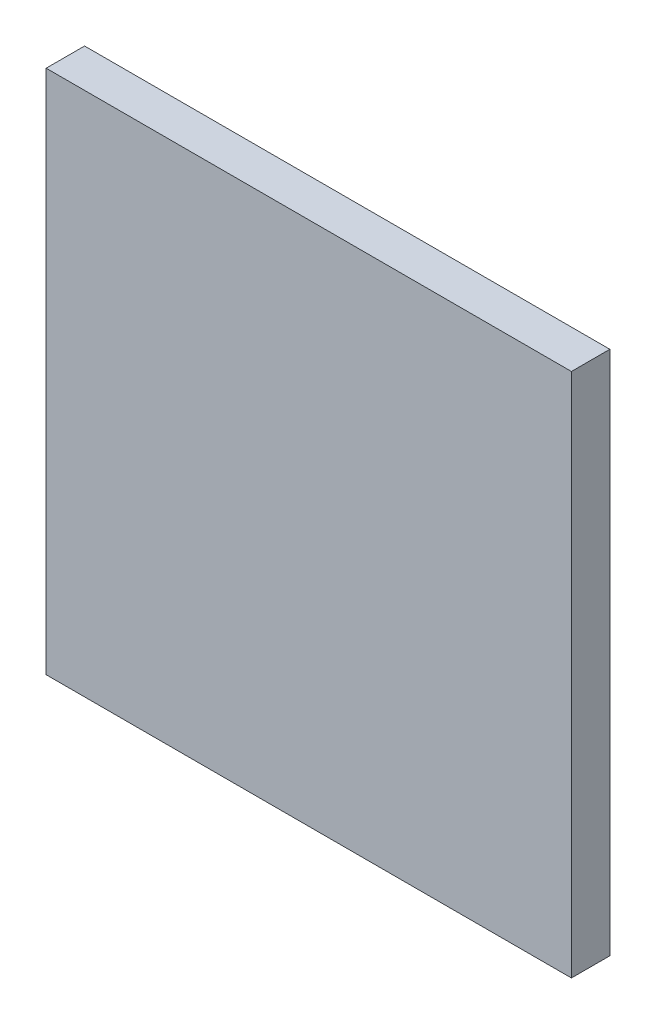
from build123d import *

# Parameters (mm, degrees)
SKETCH_2_W      = 164
SKETCH_2_H      = 164
EXTRUDE_1_DEPTH = 12
SKETCH_1_W      = 160
SKETCH_1_H      = 160
EXTRUDE_2_DEPTH = 10


with BuildPart() as part:
    # 草图2 → 凸台-拉伸1 (new body)
    with BuildSketch(Plane.XY):
        with Locations((-72.7457284, 11.344743276)):
            Rectangle(SKETCH_2_W, SKETCH_2_H)
    extrude(amount=EXTRUDE_1_DEPTH)


with BuildPart() as body_2:
    # 草图1 → 凸台-拉伸2 (new body)
    with BuildSketch(Plane.XY):
        with Locations((-72.7457284, 11.344743276)):
            Rectangle(SKETCH_1_W, SKETCH_1_H)
    extrude(amount=EXTRUDE_2_DEPTH)


with BuildPart() as part_1:
    add(part.part)

    # Combine 1: cut body 2
    add(body_2.part, mode=Mode.SUBTRACT)


solid = part_1.part
